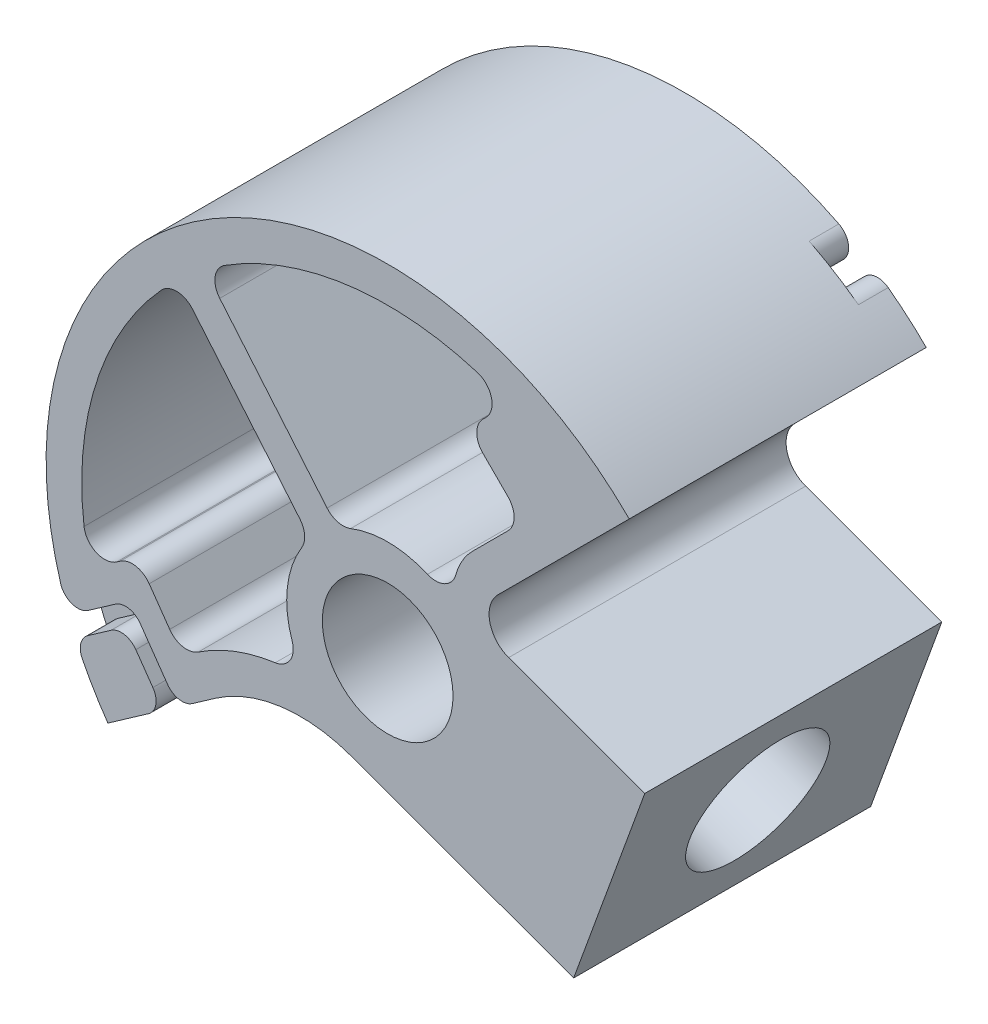
from build123d import *

# Parameters (mm, degrees)
SKETCH1_R           = 11
BOSS_EXTRUDE1_DEPTH = 50
FILLET2_R           = 25
FILLET5_R           = 5
CUT_EXTRUDE2_DEPTH  = 50
FILLET6_R           = 3.5
CUT_EXTRUDE3_DEPTH  = 5
CUT_EXTRUDE4_START  = -45
CUT_EXTRUDE4_DEPTH  = 5
CUT_EXTRUDE1_DEPTH  = 20
FILLET8_R           = 3


with BuildPart() as part:
    # Sketch1 → Boss-Extrude1 (new body)
    with BuildSketch(Plane.XY):
        with BuildLine():
            Line((-47.101242547, -32.98064509), (-15.03971276, -10.530920247))
            ThreePointArc((-15.03971276, -10.530920247), (-11.176920202, -14.566045997), (-6.279523746, -17.252849698))
            Line((-6.279523746, -17.252849698), (31.308181085, -30.933655431))
            Line((31.308181085, -30.933655431), (43.278886102, 1.955586297))
            Line((43.278886102, 1.955586297), (12.982550619, 12.982550619))
            Line((12.982550619, 12.982550619), (40.658639918, 40.658639918))
            ThreePointArc((40.658639918, 40.658639918), (-36.960287557, 44.047555479), (-47.101242547, -32.98064509))
        make_face()
        Circle(SKETCH1_R, mode=Mode.SUBTRACT)
    extrude(amount=BOSS_EXTRUDE1_DEPTH)

    # Fillet2
    fillet2_edges = [part.edges().sort_by_distance(p)[0] for p in [
        (-15.03971276, -10.530920247, 25),
    ]]
    fillet(fillet2_edges, radius=FILLET2_R)

    # Fillet5
    fillet5_edges = [part.edges().sort_by_distance(p)[0] for p in [
        (12.982550619, 12.982550619, 25),
    ]]
    fillet(fillet5_edges, radius=FILLET5_R)

    # Sketch4 → Cut-Extrude2 (cut)
    with BuildSketch(Plane.XY.offset(50)):
        with BuildLine():
            Line((-42.148022243, -6.317645709), (-34.691528571, -16.966622285))
            Line((-34.691528571, -16.966622285), (-32.46214687, -15.405592412))
            ThreePointArc((-32.46214687, -15.405592412), (-23.62229066, -11.116679876), (-13.884259621, -9.809553241))
            ThreePointArc((-13.884259621, -9.809553241), (-16.986342471, 0.681299827), (-13.054027301, 10.890012453))
            Line((-13.054027301, 10.890012453), (-35.345481592, 37.455933189))
            ThreePointArc((-35.345481592, 37.455933189), (-49.339432978, 14.76043202), (-50.108305856, -11.891496301))
            Line((-50.108305856, -11.891496301), (-42.148022243, -6.317645709))
        make_face()
        with BuildLine():
            ThreePointArc((20.41205375, 47.282111435), (-5.968485267, 51.152978248), (-30.749214933, 41.312658847))
            Line((-30.749214933, 41.312658847), (-8.457760642, 14.746738111))
            ThreePointArc((-8.457760642, 14.746738111), (1.75926732, 16.908724922), (11.312388901, 12.68975403))
            ThreePointArc((11.312388901, 12.68975403), (11.517857333, 18.111100205), (14.289586512, 22.774867886))
            Line((14.289586512, 22.774867886), (22.732981885, 31.218263259))
            Line((22.732981885, 31.218263259), (13.54059373, 40.410651415))
            Line((13.54059373, 40.410651415), (20.41205375, 47.282111435))
        make_face()
    extrude(amount=-CUT_EXTRUDE2_DEPTH, mode=Mode.SUBTRACT)

    # Fillet6
    fillet6_edges = [part.edges().sort_by_distance(p)[0] for p in [
        (-13.884259621, -9.809553241, 25),
        (-13.054027301, 10.890012453, 25),
        (-35.345481592, 37.455933189, 25),
        (-30.749214933, 41.312658847, 25),
        (-8.457760642, 14.746738111, 25),
        (11.312388901, 12.68975403, 25),
        (-50.108305856, -11.891496301, 25),
        (-34.691528571, -16.966622285, 25),
        (-42.148022243, -6.317645709, 25),
        (22.732981885, 31.218263259, 25),
        (13.54059373, 40.410651415, 25),
        (20.41205375, 47.282111435, 25),
    ]]
    fillet(fillet6_edges, radius=FILLET6_R)

    # Sketch4<3> → Cut-Extrude3 (cut)
    with BuildSketch(Plane.XY.offset(50)):
        with BuildLine():
            Line((-52.540659522, -23.360845383), (-47.522133036, -19.846835307))
            ThreePointArc((-47.522133036, -19.846835307), (-48.096606551, -18.411041206), (-48.627711525, -16.958645933))
            Line((-48.627711525, -16.958645933), (-53.713864559, -20.520008628))
            ThreePointArc((-53.713864559, -20.520008628), (-53.146246907, -21.948267351), (-52.540659522, -23.360845383))
        make_face()
        with BuildLine():
            Line((-44.112627107, -17.459473554), (-41.244744925, -21.555233775))
            Line((-41.244744925, -21.555233775), (-38.787288792, -19.834504466))
            Line((-38.787288792, -19.834504466), (-43.375900283, -13.281288112))
            Line((-43.375900283, -13.281288112), (-48.627711525, -16.958645933))
            ThreePointArc((-48.627711525, -16.958645933), (-48.096606551, -18.411041206), (-47.522133036, -19.846835307))
            Line((-47.522133036, -19.846835307), (-44.112627107, -17.459473554))
        make_face()
        Polygon((-38.787288792, -19.834504466), (-41.244744925, -21.555233775), (-37.803286307, -26.470146041), (-35.345830174, -24.749416732), align=None)
    extrude(amount=-CUT_EXTRUDE3_DEPTH, mode=Mode.SUBTRACT)

    # Sketch4<4> → Cut-Extrude4 (cut)
    with BuildSketch(Plane.XY.offset(50).offset(CUT_EXTRUDE4_START)):
        with BuildLine():
            ThreePointArc((32.12953143, 47.685880616), (30.843572778, 48.527559369), (29.535578285, 49.334568158))
            Line((29.535578285, 49.334568158), (25.145119486, 44.944109359))
            ThreePointArc((25.145119486, 44.944109359), (26.4832242, 44.168867271), (27.797449084, 43.35379827))
            Line((27.797449084, 43.35379827), (32.12953143, 47.685880616))
        make_face()
        with BuildLine():
            ThreePointArc((27.797449084, 43.35379827), (26.4832242, 44.168867271), (25.145119486, 44.944109359))
            Line((25.145119486, 44.944109359), (20.611661542, 40.410651415))
            Line((20.611661542, 40.410651415), (26.268515791, 34.753797165))
            Line((26.268515791, 34.753797165), (28.389836135, 36.875117509))
            Line((28.389836135, 36.875117509), (24.854302229, 40.410651415))
            Line((24.854302229, 40.410651415), (27.797449084, 43.35379827))
        make_face()
        Polygon((28.389836135, 36.875117509), (26.268515791, 34.753797165), (30.511156478, 30.511156478), (32.632476822, 32.632476822), align=None)
    extrude(amount=-CUT_EXTRUDE4_DEPTH, mode=Mode.SUBTRACT)

    # Sketch2 → Cut-Extrude1 (cut)
    with BuildSketch(Plane(origin=(37.587704831, -13.680805733, 0), x_dir=(0, 0, -1), z_dir=(0.939692620785907, -0.34202014332567265, 0))):
        with BuildLine():
            ThreePointArc((-13.5, -0.86009916), (-21.542647074, 10.107886559), (-34.421167086, 5.7347178))
            Line((-34.421167086, 5.7347178), (-15.578832914, -7.45491612))
            ThreePointArc((-15.578832914, -7.45491612), (-14.03201428, -4.317452086), (-13.5, -0.86009916))
        make_face()
        with BuildLine():
            Line((-15.578832914, -7.45491612), (-34.421167086, 5.7347178))
            ThreePointArc((-34.421167086, 5.7347178), (-31.59481696, -10.281266246), (-15.578832914, -7.45491612))
        make_face()
    extrude(amount=-CUT_EXTRUDE1_DEPTH, mode=Mode.SUBTRACT)

    # Fillet8
    fillet8_edges = [part.edges().sort_by_distance(p)[0] for p in [
        (-44.112627107, -17.459473554, 47.5),
        (-52.540659522, -23.360845383, 47.5),
        (-53.713864559, -20.520008628, 47.5),
        (-43.375900283, -13.281288112, 47.5),
        (-35.345830174, -24.749416732, 47.5),
        (-37.803286307, -26.470146041, 47.5),
        (30.511156478, 30.511156478, 2.5),
        (32.632476822, 32.632476822, 2.5),
        (24.854302229, 40.410651415, 2.5),
        (32.12953143, 47.685880616, 2.5),
        (29.535578285, 49.334568158, 2.5),
        (20.611661542, 40.410651415, 2.5),
    ]]
    fillet(fillet8_edges, radius=FILLET8_R)


solid = part.part
